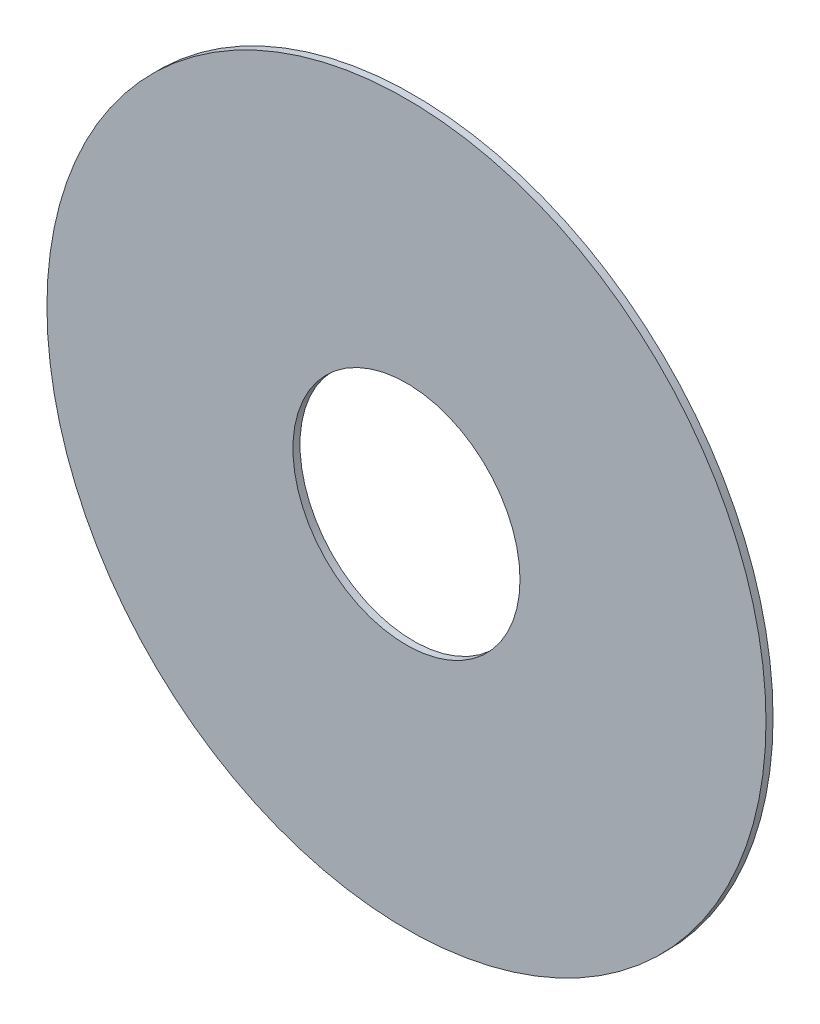
from build123d import *

# Parameters (mm, degrees)
SKETCH1_R           = 241.3
SKETCH1_R_2         = 76.2
BOSS_EXTRUDE1_DEPTH = 4.7371


with BuildPart() as part:
    # Sketch1 → Boss-Extrude1 (new body)
    with BuildSketch(Plane.XY):
        Circle(SKETCH1_R)
        Circle(SKETCH1_R_2, mode=Mode.SUBTRACT)
    extrude(amount=BOSS_EXTRUDE1_DEPTH)


solid = part.part
